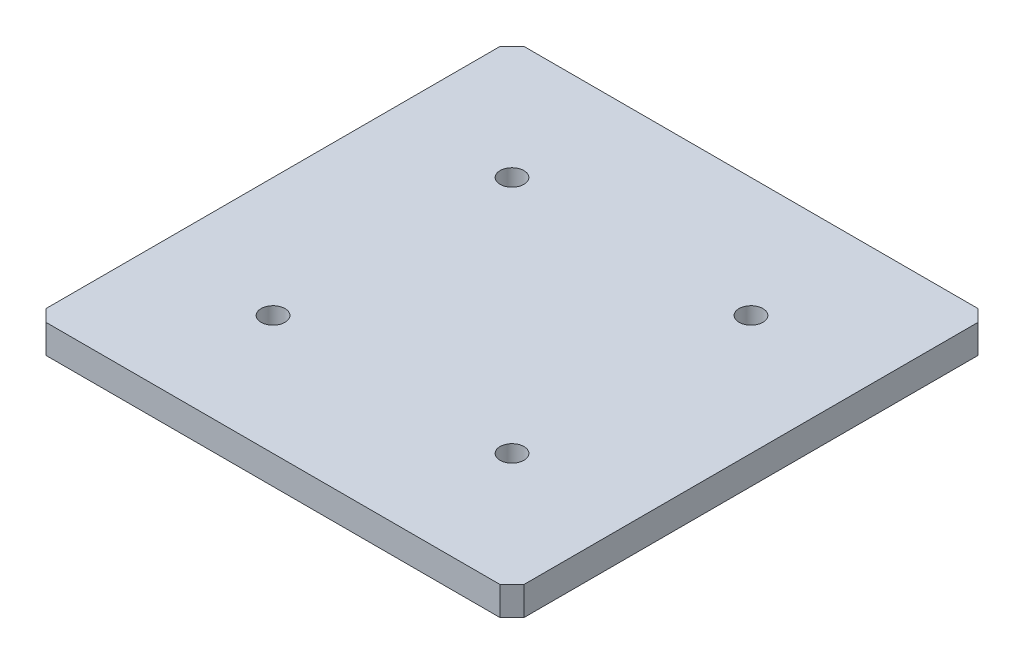
from build123d import *

# Parameters (mm, degrees)
SKETCH1_W           = 200
SKETCH1_H           = 200
BOSS_EXTRUDE1_DEPTH = 12
CUT_EXTRUDE2_REACH  = 143.93
SKETCH3_R           = 5
CHAMFER1_SIZE       = 5


with BuildPart() as part:
    # Sketch1 → Boss-Extrude1 (new body)
    with BuildSketch(Plane(origin=(0, 0, 0), x_dir=(1, 0, 0), z_dir=(0, 1, 0))):
        Rectangle(SKETCH1_W, SKETCH1_H)
    extrude(amount=BOSS_EXTRUDE1_DEPTH)

    # Sketch3 → Cut-Extrude2 (cut, up to next)
    with BuildSketch(Plane(origin=(0, 12, 0), x_dir=(1, 0, 0), z_dir=(0, 1, 0)), mode=Mode.PRIVATE) as cut_extrude2_sk1:
        with Locations(Location((-50, 50, 0), (0, 0, 270))):
            Circle(SKETCH3_R)
    cut_extrude2_tool1 = extrude(cut_extrude2_sk1.sketch, amount=-CUT_EXTRUDE2_REACH, mode=Mode.PRIVATE) & part.part
    # Sketch3 → Cut-Extrude2 (cut, up to next)
    with BuildSketch(Plane(origin=(0, 12, 0), x_dir=(1, 0, 0), z_dir=(0, 1, 0)), mode=Mode.PRIVATE) as cut_extrude2_sk2:
        with Locations(Location((50, 50, 0), (0, 0, 270))):
            Circle(SKETCH3_R)
    cut_extrude2_tool2 = extrude(cut_extrude2_sk2.sketch, amount=-CUT_EXTRUDE2_REACH, mode=Mode.PRIVATE) & part.part
    # Sketch3 → Cut-Extrude2 (cut, up to next)
    with BuildSketch(Plane(origin=(0, 12, 0), x_dir=(1, 0, 0), z_dir=(0, 1, 0)), mode=Mode.PRIVATE) as cut_extrude2_sk3:
        with Locations(Location((-50, -50, 0), (0, 0, 270))):
            Circle(SKETCH3_R)
    cut_extrude2_tool3 = extrude(cut_extrude2_sk3.sketch, amount=-CUT_EXTRUDE2_REACH, mode=Mode.PRIVATE) & part.part
    # Sketch3 → Cut-Extrude2 (cut, up to next)
    with BuildSketch(Plane(origin=(0, 12, 0), x_dir=(1, 0, 0), z_dir=(0, 1, 0)), mode=Mode.PRIVATE) as cut_extrude2_sk4:
        with Locations(Location((50, -50, 0), (0, 0, 270))):
            Circle(SKETCH3_R)
    cut_extrude2_tool4 = extrude(cut_extrude2_sk4.sketch, amount=-CUT_EXTRUDE2_REACH, mode=Mode.PRIVATE) & part.part
    add(cut_extrude2_tool1.solids().sort_by_distance((-50, 12, -50))[0], mode=Mode.SUBTRACT)
    add(cut_extrude2_tool2.solids().sort_by_distance((50, 12, -50))[0], mode=Mode.SUBTRACT)
    add(cut_extrude2_tool3.solids().sort_by_distance((-50, 12, 50))[0], mode=Mode.SUBTRACT)
    add(cut_extrude2_tool4.solids().sort_by_distance((50, 12, 50))[0], mode=Mode.SUBTRACT)

    # Chamfer1
    chamfer1_edges = [part.edges().sort_by_distance(p)[0] for p in [
        (-100, 6, -100),
        (100, 6, -100),
        (100, 6, 100),
        (-100, 6, 100),
    ]]
    chamfer(chamfer1_edges, length=CHAMFER1_SIZE)


solid = part.part
